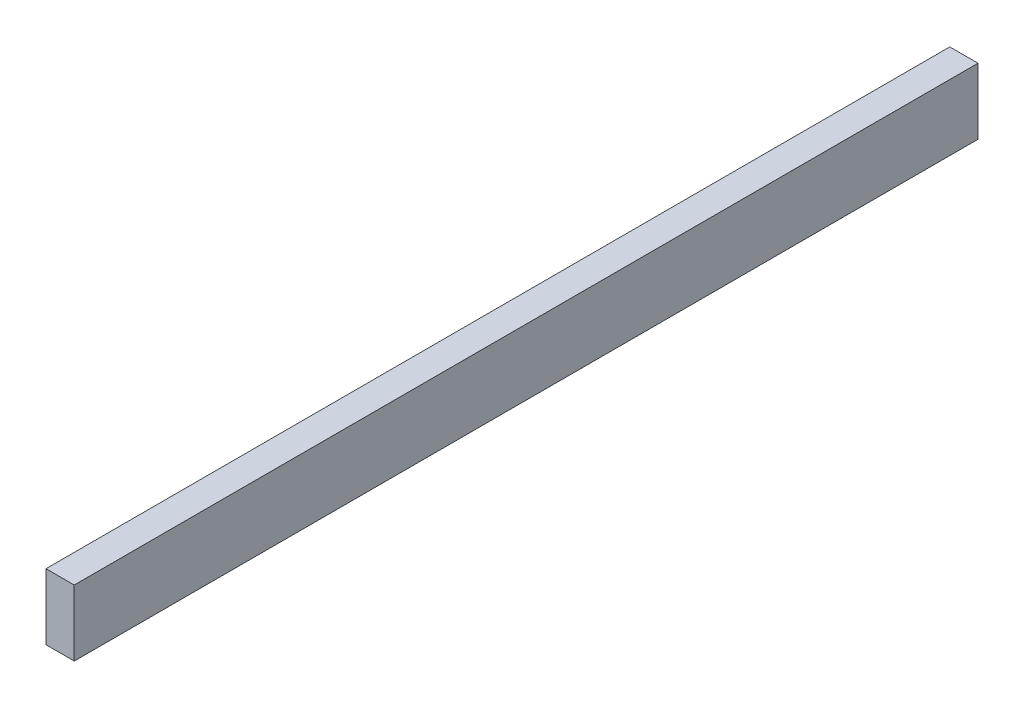
from build123d import *

# Parameters (mm, degrees)
SKETCH1_W           = 609.6
SKETCH1_H           = 44.45
BOSS_EXTRUDE1_DEPTH = 19.05


with BuildPart() as part:
    # Sketch1 → Boss-Extrude1 (new body)
    with BuildSketch(Plane(origin=(0, 0, 0), x_dir=(0, 0, -1), z_dir=(1, 0, 0))):
        with Locations((304.8, 22.225)):
            Rectangle(SKETCH1_W, SKETCH1_H)
    extrude(amount=BOSS_EXTRUDE1_DEPTH)


solid = part.part
